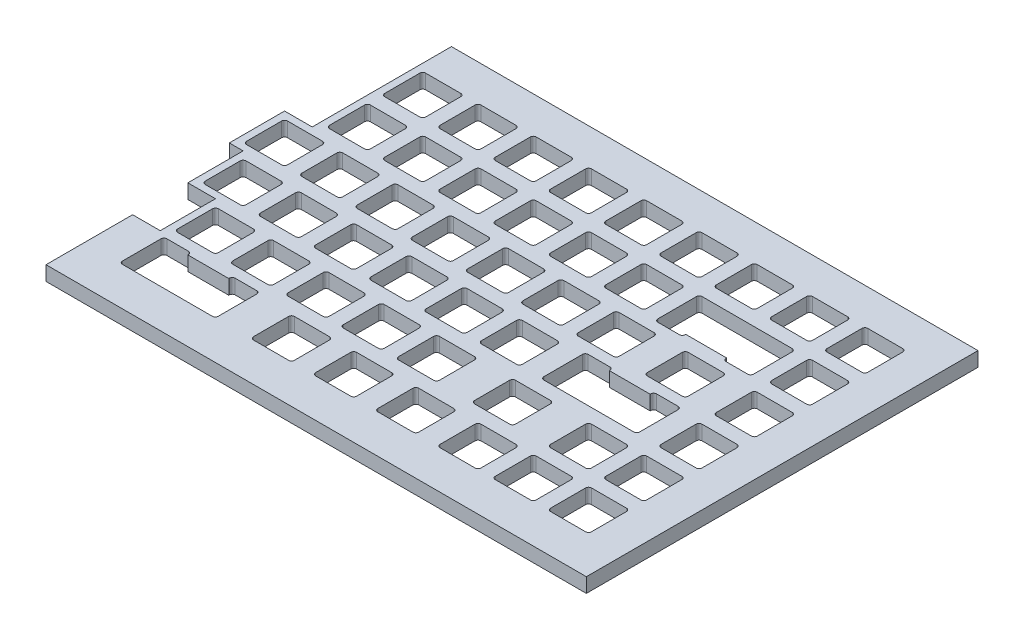
from build123d import *

# Parameters (mm, degrees)
PLATE_FRAME_DEPTH    = 5
CUT_EXTRUDE_1U_DEPTH = 234.966986186
CUT_EXTRUDE2_DEPTH   = 234.966986186
CUT_EXTRUDE3_DEPTH   = 234.966986186


with BuildPart() as part:
    # Sketch1 → Plate Frame (new body)
    with BuildSketch(Plane(origin=(0, 0, 0), x_dir=(1, 0, 0), z_dir=(0, 1, 0))):
        Polygon((0, 0), (0, 135), (-181.5, 135), (-181.5, 87), (-191.025, 87), (-191.025, 67.95), (-186.2625, 67.95), (-186.2625, 48.9), (-176.7375, 48.9), (-176.7375, 29.85), (-186.2625, 29.85), (-186.2625, 0), align=None)
    extrude(amount=PLATE_FRAME_DEPTH)

    # Sketch3 → Cut-Extrude 1U (cut, through all)
    with BuildSketch(Plane(origin=(0, 5, 0), x_dir=(1, 0, 0), z_dir=(0, 1, 0))):
        with BuildLine():
            Line((-26.625, 14.275), (-26.625, 26.375))
            ThreePointArc((-26.625, 26.375), (-26.332106781, 27.082106781), (-25.625, 27.375))
            Line((-25.625, 27.375), (-13.525, 27.375))
            ThreePointArc((-13.525, 27.375), (-12.817893219, 27.082106781), (-12.525, 26.375))
            Line((-12.525, 26.375), (-12.525, 14.275))
            ThreePointArc((-12.525, 14.275), (-12.817893219, 13.567893219), (-13.525, 13.275))
            Line((-13.525, 13.275), (-25.625, 13.275))
            ThreePointArc((-25.625, 13.275), (-26.332106781, 13.567893219), (-26.625, 14.275))
        make_face()
    cut_extrude_1u = extrude(amount=-CUT_EXTRUDE_1U_DEPTH, mode=Mode.SUBTRACT)

    # Sketch-Pattern1: Cut-Extrude 1U at 45 more places
    with Locations((0, 0, -19.05), (0, 0, -38.1), (0, 0, -57.15), (0, 0, -76.2), (0, 0, -95.25), (-19.05, 0, 0), (-38.1, 0, 0), (-19.05, 0, -19.05), (-19.05, 0, -95.25), (-38.1, 0, -95.25), (-57.15, 0, -95.25), (-76.2, 0, -95.25), (-95.25, 0, -95.25), (-114.3, 0, -95.25), (-133.35, 0, -95.25), (-152.4, 0, -95.25), (-152.4, 0, -76.2), (-133.35, 0, -76.2), (-114.3, 0, -76.2), (-95.25, 0, -76.2), (-76.2, 0, -76.2), (-57.15, 0, -76.2), (-161.925, 0, -57.15), (-142.875, 0, -57.15), (-123.825, 0, -57.15), (-104.775, 0, -57.15), (-85.725, 0, -57.15), (-66.675, 0, -57.15), (-47.625, 0, -57.15), (-138.1125, 0, -38.1), (-157.1625, 0, -38.1), (-119.0625, 0, -38.1), (-100.0125, 0, -38.1), (-80.9625, 0, -38.1), (-61.9125, 0, -38.1), (-128.5875, 0, -19.05), (-147.6375, 0, -19.05), (-109.5375, 0, -19.05), (-90.4875, 0, -19.05), (-71.4375, 0, -19.05), (-59.53125, 0, 0), (-80.9625, 0, 0), (-102.39375, 0, 0), (-45.24375, 0, -19.05), (-23.8125, 0, -57.15)):
        add(cut_extrude_1u, mode=Mode.SUBTRACT)

    # Sketch4 → Cut-Extrude2 (cut, through all)
    with BuildSketch(Plane(origin=(0, 5, 0), x_dir=(1, 0, 0), z_dir=(0, 1, 0))):
        with BuildLine():
            Line((-64.65, 89.275), (-64.65, 102.575))
            ThreePointArc((-64.65, 102.575), (-64.357106781, 103.282106781), (-63.65, 103.575))
            Line((-63.65, 103.575), (-32.65, 103.575))
            ThreePointArc((-32.65, 103.575), (-31.942893219, 103.282106781), (-31.65, 102.575))
            Line((-31.65, 102.575), (-31.65, 89.275))
            ThreePointArc((-31.65, 89.275), (-31.942893219, 88.567893219), (-32.65, 88.275))
            Line((-32.65, 88.275), (-40.1, 88.275))
            ThreePointArc((-40.1, 88.275), (-40.807106781, 88.567893219), (-41.1, 89.275))
            Line((-41.1, 89.275), (-41.1, 89.475))
            Line((-41.1, 89.475), (-55.2, 89.475))
            Line((-55.2, 89.475), (-55.2, 89.275))
            ThreePointArc((-55.2, 89.275), (-55.492893219, 88.567893219), (-56.2, 88.275))
            Line((-56.2, 88.275), (-63.65, 88.275))
            ThreePointArc((-63.65, 88.275), (-64.357106781, 88.567893219), (-64.65, 89.275))
        make_face()
    extrude(amount=-CUT_EXTRUDE2_DEPTH, mode=Mode.SUBTRACT)

    # Sketch6 → Cut-Extrude3 (cut, through all)
    with BuildSketch(Plane(origin=(0, 5, 0), x_dir=(1, 0, 0), z_dir=(0, 1, 0))):
        with BuildLine():
            Line((-173.1875, 13.275), (-142.1875, 13.275))
            ThreePointArc((-142.1875, 13.275), (-141.480393219, 13.567893219), (-141.1875, 14.275))
            Line((-141.1875, 14.275), (-141.1875, 27.575))
            ThreePointArc((-141.1875, 27.575), (-141.480393219, 28.282106781), (-142.1875, 28.575))
            Line((-142.1875, 28.575), (-149.6375, 28.575))
            ThreePointArc((-149.6375, 28.575), (-150.344606781, 28.282106781), (-150.6375, 27.575))
            Line((-150.6375, 27.575), (-150.6375, 27.375))
            Line((-150.6375, 27.375), (-164.7375, 27.375))
            Line((-164.7375, 27.375), (-164.7375, 27.575))
            ThreePointArc((-164.7375, 27.575), (-165.030393219, 28.282106781), (-165.7375, 28.575))
            Line((-165.7375, 28.575), (-173.1875, 28.575))
            ThreePointArc((-173.1875, 28.575), (-173.894606781, 28.282106781), (-174.1875, 27.575))
            Line((-174.1875, 27.575), (-174.1875, 14.275))
            ThreePointArc((-174.1875, 14.275), (-173.894606781, 13.567893219), (-173.1875, 13.275))
        make_face()
        with BuildLine():
            Line((-66.03125, 51.375), (-35.03125, 51.375))
            ThreePointArc((-35.03125, 51.375), (-34.324143219, 51.667893219), (-34.03125, 52.375))
            Line((-34.03125, 52.375), (-34.03125, 65.675))
            ThreePointArc((-34.03125, 65.675), (-34.324143219, 66.382106781), (-35.03125, 66.675))
            Line((-35.03125, 66.675), (-42.48125, 66.675))
            ThreePointArc((-42.48125, 66.675), (-43.188356781, 66.382106781), (-43.48125, 65.675))
            Line((-43.48125, 65.675), (-43.48125, 65.475))
            Line((-43.48125, 65.475), (-57.58125, 65.475))
            Line((-57.58125, 65.475), (-57.58125, 65.675))
            ThreePointArc((-57.58125, 65.675), (-57.874143219, 66.382106781), (-58.58125, 66.675))
            Line((-58.58125, 66.675), (-66.03125, 66.675))
            ThreePointArc((-66.03125, 66.675), (-66.738356781, 66.382106781), (-67.03125, 65.675))
            Line((-67.03125, 65.675), (-67.03125, 52.375))
            ThreePointArc((-67.03125, 52.375), (-66.738356781, 51.667893219), (-66.03125, 51.375))
        make_face()
    extrude(amount=-CUT_EXTRUDE3_DEPTH, mode=Mode.SUBTRACT)


solid = part.part
